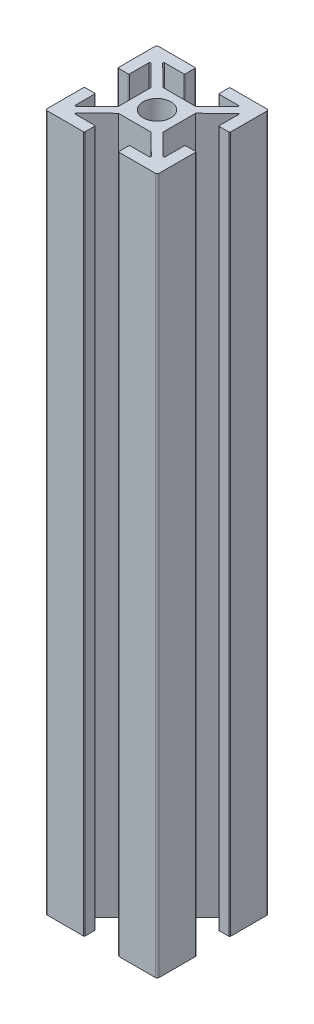
from build123d import *

# Parameters (mm, degrees)
SKETCH1_R           = 2.5
BOSS_EXTRUDE2_DEPTH = 125
SKETCH2_R           = 2
CUT_EXTRUDE1_DEPTH  = 5


with BuildPart() as part:
    # Sketch1 → Boss-Extrude2 (new body)
    with BuildSketch(Plane(origin=(0, 0, 0), x_dir=(1, 0, 0), z_dir=(0, 1, 0))):
        with BuildLine():
            Line((-9.896296296, 3), (-8.196296296, 3))
            ThreePointArc((-8.196296296, 3), (-8.090230279, 3.043933983), (-8.046296296, 3.15))
            Line((-8.046296296, 3.15), (-8.046296296, 6.586184513))
            ThreePointArc((-8.046296296, 6.586184513), (-7.954097251, 6.724600732), (-7.790842301, 6.692859041))
            Line((-7.790842301, 6.692859041), (-4, 2.945390222))
            Line((-4, 2.945390222), (-4, -2.945390222))
            Line((-4, -2.945390222), (-7.790842301, -6.692859041))
            ThreePointArc((-7.790842301, -6.692859041), (-7.954097251, -6.724600732), (-8.046296296, -6.586184513))
            Line((-8.046296296, -6.586184513), (-8.046296296, -3.15))
            ThreePointArc((-8.046296296, -3.15), (-8.090230279, -3.043933983), (-8.196296296, -3))
            Line((-8.196296296, -3), (-9.896296296, -3))
            ThreePointArc((-9.896296296, -3), (-10.002362313, -3.043933983), (-10.046296296, -3.15))
            Line((-10.046296296, -3.15), (-10.046296296, -9.65))
            ThreePointArc((-10.046296296, -9.65), (-9.94378367, -9.897487373), (-9.696296296, -10))
            Line((-9.696296296, -10), (-3.196296296, -10))
            ThreePointArc((-3.196296296, -10), (-3.090230279, -9.956066017), (-3.046296296, -9.85))
            Line((-3.046296296, -9.85), (-3.046296296, -8.15))
            ThreePointArc((-3.046296296, -8.15), (-3.090230279, -8.043933983), (-3.196296296, -8))
            Line((-3.196296296, -8), (-6.614381093, -8))
            ThreePointArc((-6.614381093, -8), (-6.753127587, -7.9070036), (-6.719835089, -7.743325472))
            Line((-6.719835089, -7.743325472), (-2.93318409, -4))
            Line((-2.93318409, -4), (2.93318409, -4))
            Line((2.93318409, -4), (6.719835089, -7.743325472))
            ThreePointArc((6.719835089, -7.743325472), (6.753127587, -7.9070036), (6.614381093, -8))
            Line((6.614381093, -8), (3.196296296, -8))
            ThreePointArc((3.196296296, -8), (3.090230279, -8.043933983), (3.046296296, -8.15))
            Line((3.046296296, -8.15), (3.046296296, -9.85))
            ThreePointArc((3.046296296, -9.85), (3.090230279, -9.956066017), (3.196296296, -10))
            Line((3.196296296, -10), (9.696296296, -10))
            ThreePointArc((9.696296296, -10), (9.94378367, -9.897487373), (10.046296296, -9.65))
            Line((10.046296296, -9.65), (10.046296296, -3.15))
            ThreePointArc((10.046296296, -3.15), (10.002362313, -3.043933983), (9.896296296, -3))
            Line((9.896296296, -3), (8.196296296, -3))
            ThreePointArc((8.196296296, -3), (8.090230279, -3.043933983), (8.046296296, -3.15))
            Line((8.046296296, -3.15), (8.046296296, -6.586184513))
            ThreePointArc((8.046296296, -6.586184513), (7.954097251, -6.724600732), (7.790842301, -6.692859041))
            Line((7.790842301, -6.692859041), (4, -2.945390222))
            Line((4, -2.945390222), (4, 2.945390222))
            Line((4, 2.945390222), (7.790842301, 6.692859041))
            ThreePointArc((7.790842301, 6.692859041), (7.954097251, 6.724600732), (8.046296296, 6.586184513))
            Line((8.046296296, 6.586184513), (8.046296296, 3.15))
            ThreePointArc((8.046296296, 3.15), (8.090230279, 3.043933983), (8.196296296, 3))
            Line((8.196296296, 3), (9.896296296, 3))
            ThreePointArc((9.896296296, 3), (10.002362313, 3.043933983), (10.046296296, 3.15))
            Line((10.046296296, 3.15), (10.046296296, 9.65))
            ThreePointArc((10.046296296, 9.65), (9.94378367, 9.897487373), (9.696296296, 10))
            Line((9.696296296, 10), (3.196296296, 10))
            ThreePointArc((3.196296296, 10), (3.090230279, 9.956066017), (3.046296296, 9.85))
            Line((3.046296296, 9.85), (3.046296296, 8.15))
            ThreePointArc((3.046296296, 8.15), (3.090230279, 8.043933983), (3.196296296, 8))
            Line((3.196296296, 8), (6.614381093, 8))
            ThreePointArc((6.614381093, 8), (6.753127587, 7.9070036), (6.719835089, 7.743325472))
            Line((6.719835089, 7.743325472), (2.93318409, 4))
            Line((2.93318409, 4), (-2.93318409, 4))
            Line((-2.93318409, 4), (-6.719835089, 7.743325472))
            ThreePointArc((-6.719835089, 7.743325472), (-6.753127587, 7.9070036), (-6.614381093, 8))
            Line((-6.614381093, 8), (-3.196296296, 8))
            ThreePointArc((-3.196296296, 8), (-3.090230279, 8.043933983), (-3.046296296, 8.15))
            Line((-3.046296296, 8.15), (-3.046296296, 9.85))
            ThreePointArc((-3.046296296, 9.85), (-3.090230279, 9.956066017), (-3.196296296, 10))
            Line((-3.196296296, 10), (-9.696296296, 10))
            ThreePointArc((-9.696296296, 10), (-9.94378367, 9.897487373), (-10.046296296, 9.65))
            Line((-10.046296296, 9.65), (-10.046296296, 3.15))
            ThreePointArc((-10.046296296, 3.15), (-10.002362313, 3.043933983), (-9.896296296, 3))
        make_face()
        with Locations(Location((0, 0, 0), (0, 0, 270))):
            Circle(SKETCH1_R, mode=Mode.SUBTRACT)
    extrude(amount=BOSS_EXTRUDE2_DEPTH)

    # Sketch2 → Cut-Extrude1 (cut)
    with BuildSketch(Plane.XY.offset(4)):
        with Locations((0, 115.362899348)):
            Circle(SKETCH2_R)
        with Locations((0, 75.362899348)):
            Circle(SKETCH2_R)
    extrude(amount=-CUT_EXTRUDE1_DEPTH, mode=Mode.SUBTRACT)


solid = part.part
